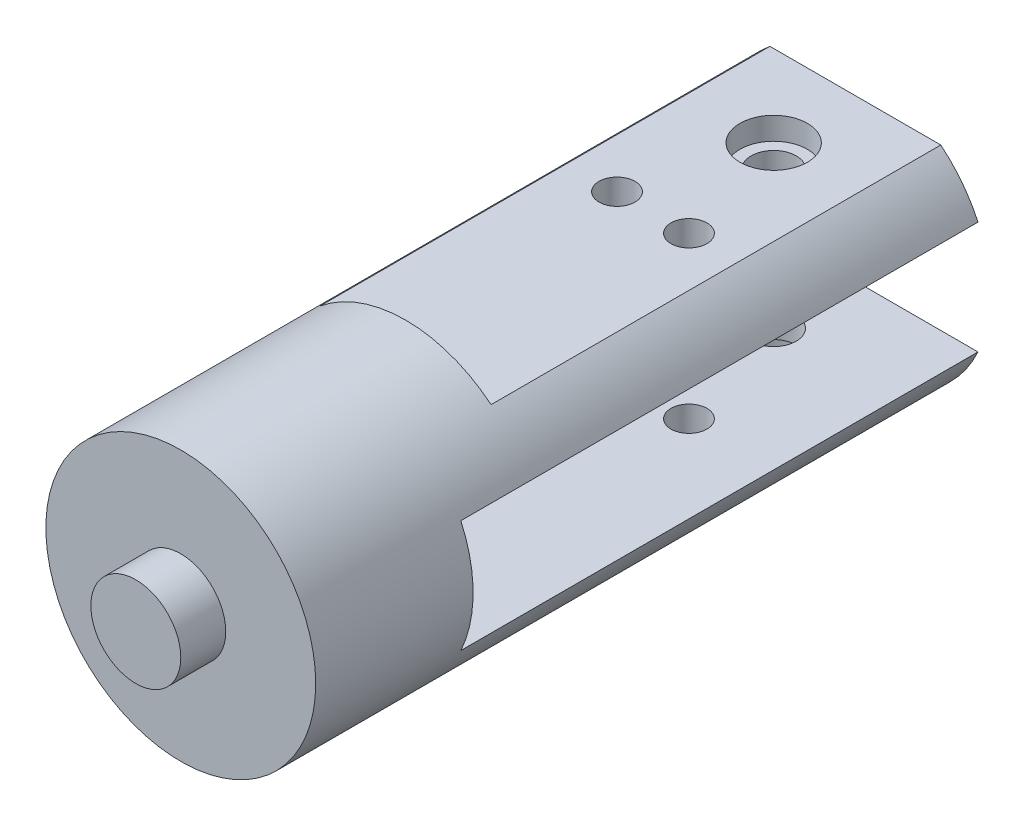
from build123d import *

# Parameters (mm, degrees)
IZIM1_R                     = 30
IZIM1_R_2                   = 10
Y_KSEKLIK_EKSTR_ZYON2_DEPTH = 25
IZIM1_4_R                   = 10
Y_KSEKLIK_EKSTR_ZYON3_DEPTH = 35
Y_KSEKLIK_EKSTR_ZYON4_START = -125
IZIM1_5_R                   = 30
IZIM1_5_R_2                 = 10
Y_KSEKLIK_EKSTR_ZYON4_DEPTH = 125
IZIM3_W                     = 54.543560574
IZIM3_H                     = 25
KES_EKSTR_ZYON1_DEPTH       = 115
KES_EKSTR_ZYON2_DEPTH       = 100
IZIM5_R                     = 4
KES_EKSTR_ZYON3_DEPTH       = 100
KES_EKSTR_ZYON4_DEPTH       = 5
KES_EKSTR_ZYON5_DEPTH       = 35.716373532
L_EK1_SCALE                 = 0.3


with BuildPart() as part:
    # Çizim1 → Yükseklik-Ekstrüzyon2 (new body)
    # profile 1 of 2: a face of its own
    with BuildSketch(Plane.XY):
        Circle(IZIM1_R)
        Circle(IZIM1_R_2, mode=Mode.SUBTRACT)
    # profile 2 of 2: a face of its own
    with BuildSketch(Plane.XY):
        Circle(IZIM1_R_2)
    extrude(amount=Y_KSEKLIK_EKSTR_ZYON2_DEPTH)

    # Çizim1<4> → Yükseklik-Ekstrüzyon3 (add)
    with BuildSketch(Plane.XY):
        Circle(IZIM1_4_R)
    extrude(amount=Y_KSEKLIK_EKSTR_ZYON3_DEPTH)

    # Çizim1<5> → Yükseklik-Ekstrüzyon4 (add)
    # profile 1 of 2: a face of its own
    with BuildSketch(Plane.XY.offset(Y_KSEKLIK_EKSTR_ZYON4_START)):
        Circle(IZIM1_5_R)
        Circle(IZIM1_5_R_2, mode=Mode.SUBTRACT)
    # profile 2 of 2: a face of its own
    with BuildSketch(Plane.XY.offset(Y_KSEKLIK_EKSTR_ZYON4_START)):
        Circle(IZIM1_5_R_2)
    extrude(amount=Y_KSEKLIK_EKSTR_ZYON4_DEPTH)

    # Çizim3 → Kes-Ekstrüzyon1 (cut)
    with BuildSketch(Plane(origin=(0, 0, -125), x_dir=(-1, 0, 0), z_dir=(0, 0, -1))):
        Rectangle(IZIM3_W, IZIM3_H)
        with BuildLine():
            Line((-27.271780287, -12.5), (-27.271780287, 12.5))
            ThreePointArc((-27.271780287, 12.5), (-30, 0), (-27.271780287, -12.5))
        make_face()
        with BuildLine():
            ThreePointArc((27.271780287, -12.5), (30, 0), (27.271780287, 12.5))
            Line((27.271780287, 12.5), (27.271780287, -12.5))
        make_face()
    extrude(amount=-KES_EKSTR_ZYON1_DEPTH, mode=Mode.SUBTRACT)

    # Çizim4 → Kes-Ekstrüzyon2 (cut)
    with BuildSketch(Plane(origin=(0, 0, -125), x_dir=(-1, 0, 0), z_dir=(0, 0, -1))):
        with BuildLine():
            Line((-19, 23.216373532), (19, 23.216373532))
            ThreePointArc((19, 23.216373532), (0, 30), (-19, 23.216373532))
        make_face()
        with BuildLine():
            Line((-19, -23.216373532), (19, -23.216373532))
            ThreePointArc((19, -23.216373532), (0, -30), (-19, -23.216373532))
        make_face()
    extrude(amount=-KES_EKSTR_ZYON2_DEPTH, mode=Mode.SUBTRACT)

    # Çizim5 → Kes-Ekstrüzyon3 (cut)
    with BuildSketch(Plane(origin=(0, 23.216373532, 0), x_dir=(1, 0, 0), z_dir=(0, 1, 0))):
        with Locations(Location((-8, 80, 0), (0, 0, 270))):
            Circle(IZIM5_R)
        with Locations(Location((8, 80, 0), (0, 0, 270))):
            Circle(IZIM5_R)
    extrude(amount=-KES_EKSTR_ZYON3_DEPTH, mode=Mode.SUBTRACT)

    # Çizim6 → Kes-Ekstrüzyon4 (cut)
    with BuildSketch(Plane(origin=(0, 23.216373532, 0), x_dir=(1, 0, 0), z_dir=(0, 1, 0))):
        with BuildLine():
            ThreePointArc((5, 106.843021333), (3.535533906, 110.378555239), (0, 111.843021333))
            Line((0, 111.843021333), (0, 101.843021333))
            ThreePointArc((0, 101.843021333), (3.535533906, 103.307487427), (5, 106.843021333))
        make_face()
        with BuildLine():
            Line((0, 101.843021333), (0, 111.843021333))
            ThreePointArc((0, 111.843021333), (-5, 106.843021333), (0, 101.843021333))
        make_face()
        with BuildLine():
            ThreePointArc((7.5, 106.843021333), (5.303300859, 112.146322192), (0, 114.343021333))
            Line((0, 114.343021333), (0, 111.843021333))
            ThreePointArc((0, 111.843021333), (3.535533906, 110.378555239), (5, 106.843021333))
            ThreePointArc((5, 106.843021333), (3.535533906, 103.307487427), (0, 101.843021333))
            Line((0, 101.843021333), (0, 99.343021333))
            ThreePointArc((0, 99.343021333), (5.303300859, 101.539720474), (7.5, 106.843021333))
        make_face()
        with BuildLine():
            Line((0, 111.843021333), (0, 114.343021333))
            ThreePointArc((0, 114.343021333), (-7.5, 106.843021333), (0, 99.343021333))
            Line((0, 99.343021333), (0, 101.843021333))
            ThreePointArc((0, 101.843021333), (-5, 106.843021333), (0, 111.843021333))
        make_face()
    kes_ekstr_zyon4 = extrude(amount=-KES_EKSTR_ZYON4_DEPTH, mode=Mode.SUBTRACT)

    # Çizim6<3> → Kes-Ekstrüzyon5 (cut)
    with BuildSketch(Plane(origin=(0, 23.216373532, 0), x_dir=(1, 0, 0), z_dir=(0, 1, 0))):
        with BuildLine():
            ThreePointArc((5, 106.843021333), (3.535533906, 110.378555239), (0, 111.843021333))
            Line((0, 111.843021333), (0, 101.843021333))
            ThreePointArc((0, 101.843021333), (3.535533906, 103.307487427), (5, 106.843021333))
        make_face()
        with BuildLine():
            Line((0, 101.843021333), (0, 111.843021333))
            ThreePointArc((0, 111.843021333), (-5, 106.843021333), (0, 101.843021333))
        make_face()
    kes_ekstr_zyon5 = extrude(amount=-KES_EKSTR_ZYON5_DEPTH, mode=Mode.SUBTRACT)

    # Aynalama1: Kes-Ekstrüzyon4, Kes-Ekstrüzyon5 across plane
    add(kes_ekstr_zyon4.mirror(Plane.ZX), mode=Mode.SUBTRACT)
    add(kes_ekstr_zyon5.mirror(Plane.ZX), mode=Mode.SUBTRACT)


with BuildPart() as part_1:
    # Ölçek1: scaled about (0, 0, -30.54358769)
    add(part.part.scale(L_EK1_SCALE).moved(Location((0, 0, -21.380511383))))


solid = part_1.part
